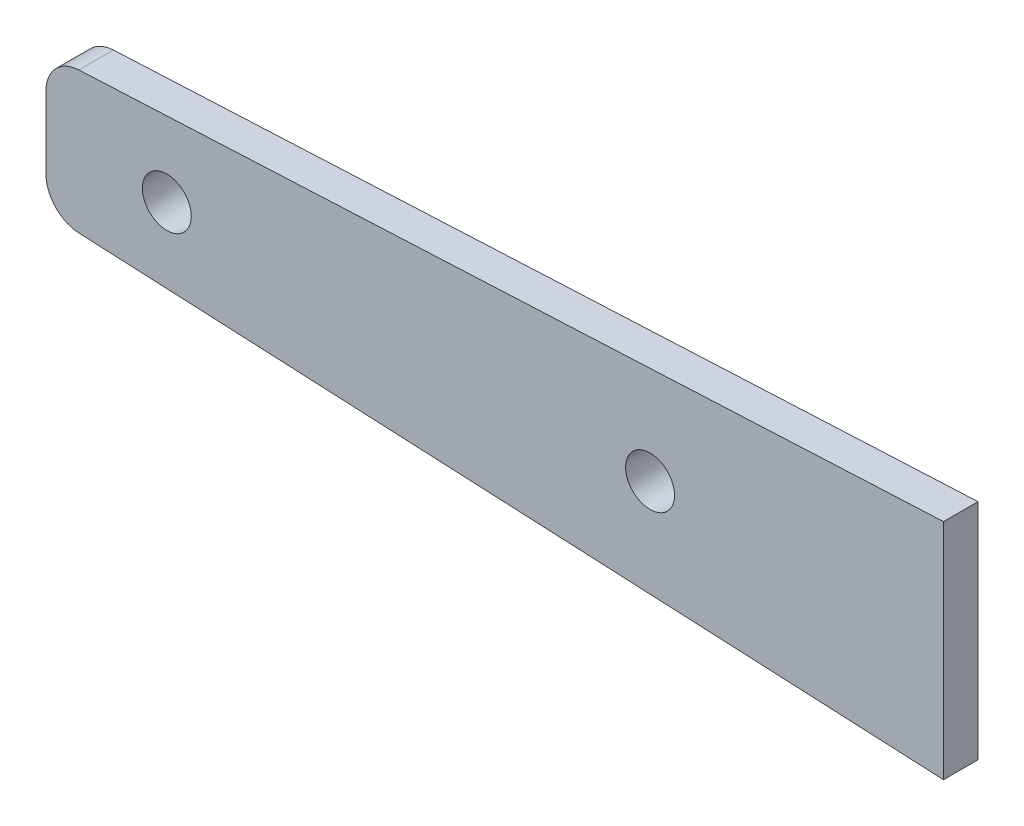
from build123d import *

# Parameters (mm, degrees)
BOSS_EXTRUDE1_DEPTH  = 3.175
M4_CLEARANCE_HOLE2_D = 4.5
FILLET1_R            = 3.175


with BuildPart() as part:
    # Sketch1 → Boss-Extrude1 (new body)
    with BuildSketch(Plane.XY):
        Polygon((49.2125, 10.280952381), (-33.3375, 6.35), (-33.3375, -6.35), (49.2125, -10.280952381), align=None)
    extrude(amount=BOSS_EXTRUDE1_DEPTH)

    # M4 Clearance Hole2 (through all)
    with Locations(Plane.XY.offset(3.175)):
        with Locations((-22.225, 0), (22.225, 0)):
            Hole(M4_CLEARANCE_HOLE2_D / 2)

    # Fillet1
    fillet1_edges = [part.edges().sort_by_distance(p)[0] for p in [
        (-33.3375, -6.35, 1.5875),
        (-33.3375, 6.35, 1.5875),
    ]]
    fillet(fillet1_edges, radius=FILLET1_R)


solid = part.part
